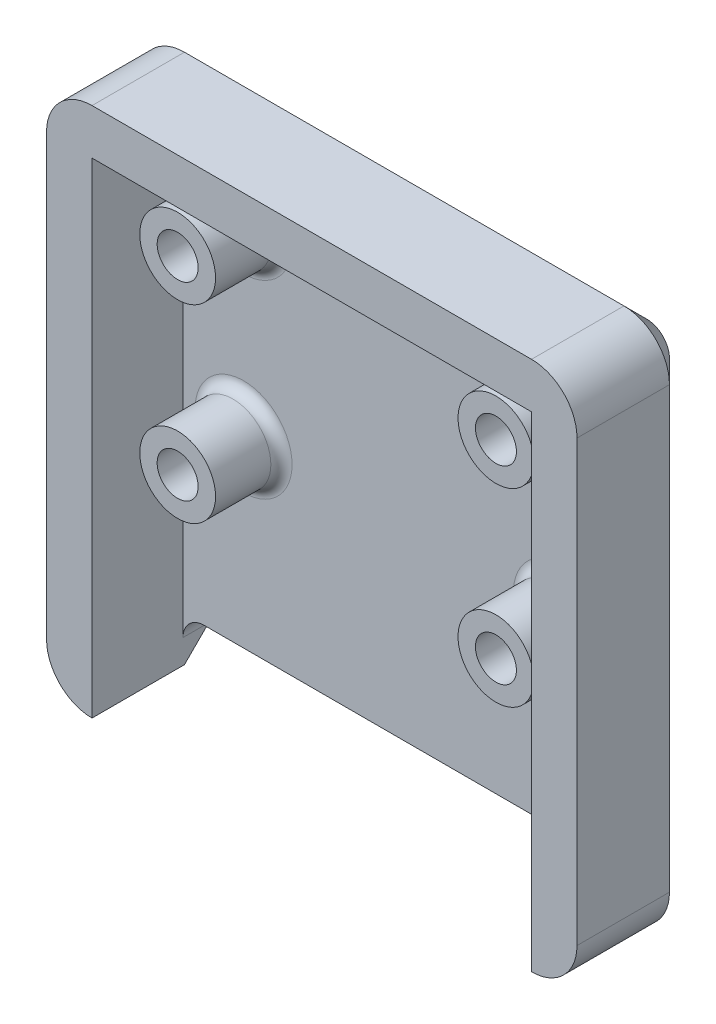
from build123d import *

# Parameters (mm, degrees)
BOSS_EXTRUDE1_DEPTH                               = 1.6
BOSS_EXTRUDE2_START                               = 6
BOSS_EXTRUDE2_DEPTH                               = 6
CSK_FOR_2_FLAT_HEAD_MACHINE_SCREW_100_D           = 2.7051
CSK_FOR_2_FLAT_HEAD_MACHINE_SCREW_100_CSINK_D     = 4.3688
CSK_FOR_2_FLAT_HEAD_MACHINE_SCREW_100_CSINK_ANGLE = 100
BOSS_EXTRUDE3_START                               = 4.35
SKETCH7_R                                         = 2.5
SKETCH7_R_2                                       = 1.35255
BOSS_EXTRUDE3_DEPTH                               = 4.35
FILLET1_R                                         = 0.7
FILLET3_R                                         = 1.4
CHAMFER1_SIZE                                     = 1.5


with BuildPart() as part:
    # Sketch1 → Boss-Extrude1 (new body)
    with BuildSketch(Plane.XY):
        with BuildLine():
            Line((-17.5, 14.5), (-17.5, -14.5))
            ThreePointArc((-17.5, -14.5), (-16.621320344, -16.621320344), (-14.5, -17.5))
            Line((-14.5, -17.5), (-14.5, -14.5))
            Line((-14.5, -14.5), (14.5, -14.5))
            Line((14.5, -14.5), (14.5, -17.5))
            ThreePointArc((14.5, -17.5), (16.621320344, -16.621320344), (17.5, -14.5))
            Line((17.5, -14.5), (17.5, 14.5))
            ThreePointArc((17.5, 14.5), (16.621320344, 16.621320344), (14.5, 17.5))
            Line((14.5, 17.5), (-14.5, 17.5))
            ThreePointArc((-14.5, 17.5), (-16.621320344, 16.621320344), (-17.5, 14.5))
        make_face()
    extrude(amount=-BOSS_EXTRUDE1_DEPTH)

    # Sketch1<3> → Boss-Extrude2 (add)
    with BuildSketch(Plane.XY.offset(BOSS_EXTRUDE2_START)):
        with BuildLine():
            ThreePointArc((-17.5, 14.5), (-16.621320344, 16.621320344), (-14.5, 17.5))
            Line((-14.5, 17.5), (14.5, 17.5))
            ThreePointArc((14.5, 17.5), (16.621320344, 16.621320344), (17.5, 14.5))
            Line((17.5, 14.5), (17.5, -14.5))
            ThreePointArc((17.5, -14.5), (16.621320344, -16.621320344), (14.5, -17.5))
            Line((14.5, -17.5), (14.5, -14.5))
            Line((14.5, -14.5), (14.5, 14.5))
            Line((14.5, 14.5), (-14.5, 14.5))
            Line((-14.5, 14.5), (-14.5, -14.5))
            Line((-14.5, -14.5), (-14.5, -17.5))
            ThreePointArc((-14.5, -17.5), (-16.621320344, -16.621320344), (-17.5, -14.5))
            Line((-17.5, -14.5), (-17.5, 14.5))
        make_face()
    extrude(amount=-BOSS_EXTRUDE2_DEPTH)

    # CSK for #2 Flat Head Machine Screw (100)1 (through all)
    with Locations(Plane(origin=(0, 0, -1.6), x_dir=(-1, 0, 0), z_dir=(0, 0, -1))):
        with Locations((10.5, 10.08), (10.5, -2.42), (-10.5, 10.08), (-10.5, -2.42)):
            CounterSinkHole(CSK_FOR_2_FLAT_HEAD_MACHINE_SCREW_100_D / 2, CSK_FOR_2_FLAT_HEAD_MACHINE_SCREW_100_CSINK_D / 2, counter_sink_angle=CSK_FOR_2_FLAT_HEAD_MACHINE_SCREW_100_CSINK_ANGLE)

    # Sketch7 → Boss-Extrude3 (add)
    # profile 1 of 4: a face of its own
    with BuildSketch(Plane.XY.offset(BOSS_EXTRUDE3_START)):
        with Locations((-10.5, 10.08)):
            Circle(SKETCH7_R)
        with Locations(Location((-10.5, 10.08, 0), (0, 0, 180))):
            Circle(SKETCH7_R_2, mode=Mode.SUBTRACT)
    # profile 2 of 4: a face of its own
    with BuildSketch(Plane.XY.offset(BOSS_EXTRUDE3_START)):
        with Locations((10.5, 10.08)):
            Circle(SKETCH7_R)
        with Locations(Location((10.5, 10.08, 0), (0, 0, 180))):
            Circle(SKETCH7_R_2, mode=Mode.SUBTRACT)
    # profile 3 of 4: a face of its own
    with BuildSketch(Plane.XY.offset(BOSS_EXTRUDE3_START)):
        with Locations((10.5, -2.42)):
            Circle(SKETCH7_R)
        with Locations(Location((10.5, -2.42, 0), (0, 0, 180))):
            Circle(SKETCH7_R_2, mode=Mode.SUBTRACT)
    # profile 4 of 4: a face of its own
    with BuildSketch(Plane.XY.offset(BOSS_EXTRUDE3_START)):
        with Locations((-10.5, -2.42)):
            Circle(SKETCH7_R)
        with Locations(Location((-10.5, -2.42, 0), (0, 0, 180))):
            Circle(SKETCH7_R_2, mode=Mode.SUBTRACT)
    extrude(amount=-BOSS_EXTRUDE3_DEPTH)

    # Fillet1
    fillet1_edges = [part.edges().sort_by_distance(p)[0] for p in [
        (8, -2.42, 0),
        (-13, -2.42, 0),
        (-13, 10.08, 0),
        (8, 10.08, 0),
    ]]
    fillet(fillet1_edges, radius=FILLET1_R)

    # Fillet3
    fillet3_edges = [part.edges().sort_by_distance(p)[0] for p in [
        (14.5, -14.5, -0.8),
        (-14.5, -14.5, -0.8),
    ]]
    fillet(fillet3_edges, radius=FILLET3_R)

    # Chamfer1
    chamfer1_edges = [part.edges().sort_by_distance(p)[0] for p in [
        (16.621320344, -16.621320344, -1.6),
        (17.5, 0, -1.6),
        (16.621320344, 16.621320344, -1.6),
        (0, 17.5, -1.6),
        (-16.621320344, 16.621320344, -1.6),
        (-17.5, 0, -1.6),
        (-16.621320344, -16.621320344, -1.6),
    ]]
    chamfer(chamfer1_edges, length=CHAMFER1_SIZE)


solid = part.part
